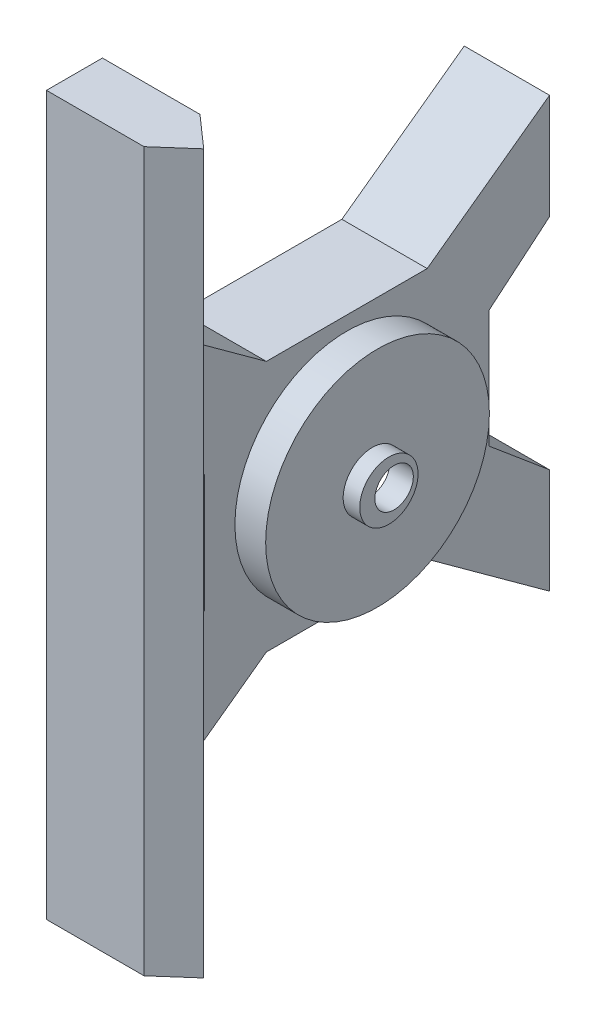
from build123d import *

# Parameters (mm, degrees)
BOSS_EXTRUDE1_DEPTH      = 610
SKETCH5_R                = 800
BOSS_EXTRUDE2_DEPTH      = 830
SHELL1_T                 = -50
SKETCH6_R                = 137.5
CUT_EXTRUDE6_DEPTH       = 830
BOSS_EXTRUDE3_START      = 118.5
SKETCH7_R                = 208.5
SKETCH7_R_2              = 137.5
BOSS_EXTRUDE3_DEPTH      = 118.5
BOSS_EXTRUDE5_DEPTH      = 2667.5
BOSS_EXTRUDE5_DEPTH_BACK = 2467.5


with BuildPart() as part:
    # Sketch1 → Boss-Extrude1 (new body)
    with BuildSketch(Plane(origin=(0, 0, 0), x_dir=(0, 0, -1), z_dir=(1, 0, 0))):
        Polygon((575, 900), (-575, 900), (-1450, 1535.724712005), (-1450, 783.82001496), (-1016.594085516, 420.149271967), (-1016.594085516, -420.149271967), (-1450, -783.82001496), (-1450, -1535.724712005), (-575, -900), (575, -900), (1450, -1535.724712005), (1450, -783.82001496), (1016.594085516, -420.149271967), (1016.594085516, 420.149271967), (1450, 783.82001496), (1450, 1535.724712005), align=None)
    extrude(amount=BOSS_EXTRUDE1_DEPTH)

    # Sketch5 → Boss-Extrude2 (add)
    with BuildSketch(Plane(origin=(0, 0, 0), x_dir=(0, 0, -1), z_dir=(1, 0, 0))):
        Circle(SKETCH5_R)
    extrude(amount=BOSS_EXTRUDE2_DEPTH)

    # Shell1
    shell1_openings = [part.faces().sort_by_distance(p)[0] for p in [
        (0, 0, 0),
    ]]
    offset(amount=SHELL1_T, openings=shell1_openings, kind=Kind.INTERSECTION)

    # Sketch6 → Cut-Extrude6 (cut)
    with BuildSketch(Plane(origin=(830, 0, 0), x_dir=(0, 0, -1), z_dir=(1, 0, 0))):
        Circle(SKETCH6_R)
    extrude(amount=-CUT_EXTRUDE6_DEPTH, mode=Mode.SUBTRACT)

    # Sketch7 → Boss-Extrude3 (add)
    with BuildSketch(Plane(origin=(830, 0, 0), x_dir=(0, 0, -1), z_dir=(1, 0, 0)).offset(BOSS_EXTRUDE3_START)):
        with Locations((-37.279706597, 0)):
            Circle(SKETCH7_R)
        Circle(SKETCH7_R_2, mode=Mode.SUBTRACT)
    extrude(amount=-BOSS_EXTRUDE3_DEPTH)

    # Sketch8 → Boss-Extrude5 (add, two sides: drawn at the far end of the back side and taken through both)
    with BuildSketch(Plane(origin=(0, 0, 0), x_dir=(1, 0, 0), z_dir=(0, 1, 0)).offset(-BOSS_EXTRUDE5_DEPTH_BACK)):
        Polygon((837.233623205, -1250), (610, -1450), (-87.5, -1450), (-87.5, -1050), (610, -1050), align=None)
    extrude(amount=BOSS_EXTRUDE5_DEPTH + BOSS_EXTRUDE5_DEPTH_BACK)


solid = part.part
